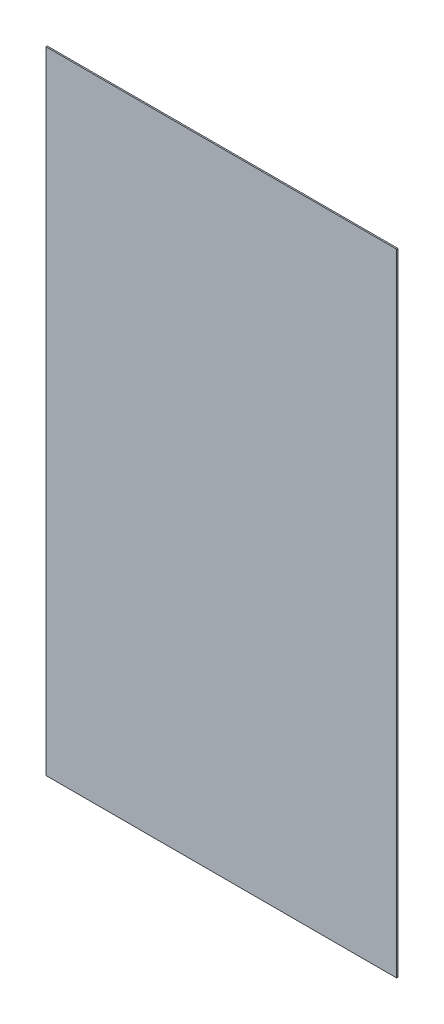
from build123d import *

# Parameters (mm, degrees)
CROQUIS1_W              = 500
CROQUIS1_H              = 900
SALIENTE_EXTRUIR1_DEPTH = 1.9


with BuildPart() as part:
    # Croquis1 → Saliente-Extruir1 (new body)
    with BuildSketch(Plane.XY):
        Rectangle(CROQUIS1_W, CROQUIS1_H)
    extrude(amount=SALIENTE_EXTRUIR1_DEPTH)


solid = part.part
